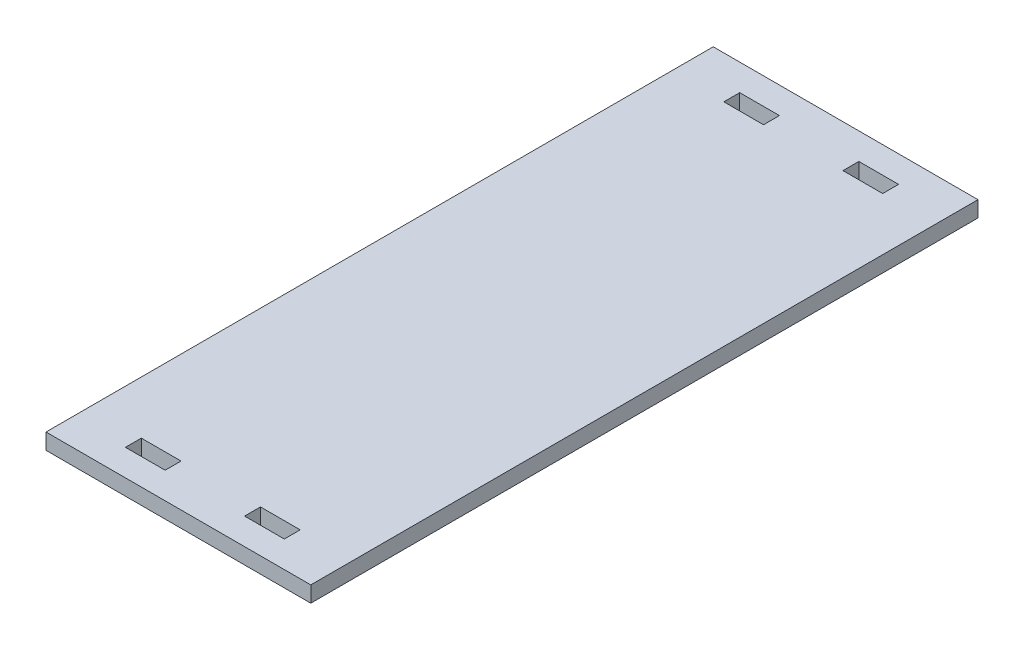
from build123d import *

# Parameters (mm, degrees)
SKETCH1_W           = 100
SKETCH1_H           = 252
SKETCH1_W_2         = 15
SKETCH1_H_2         = 6
BOSS_EXTRUDE1_DEPTH = 6


with BuildPart() as part:
    # Sketch1 → Boss-Extrude1 (new body)
    with BuildSketch(Plane(origin=(0, 0, 0), x_dir=(1, 0, 0), z_dir=(0, 1, 0))):
        with Locations((-50, -126)):
            Rectangle(SKETCH1_W, SKETCH1_H)
        with Locations((-72.5, -13)):
            Rectangle(SKETCH1_W_2, SKETCH1_H_2, mode=Mode.SUBTRACT)
        with Locations((-27.5, -13)):
            Rectangle(SKETCH1_W_2, SKETCH1_H_2, mode=Mode.SUBTRACT)
        with Locations((-72.5, -239)):
            Rectangle(SKETCH1_W_2, SKETCH1_H_2, mode=Mode.SUBTRACT)
        with Locations((-27.5, -239)):
            Rectangle(SKETCH1_W_2, SKETCH1_H_2, mode=Mode.SUBTRACT)
    extrude(amount=BOSS_EXTRUDE1_DEPTH)


solid = part.part
